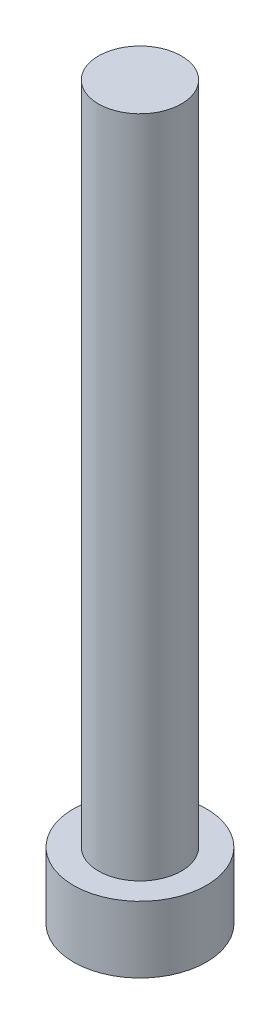
from build123d import *

# Parameters (mm, degrees)
SKETCH1_R           = 1.25
BOSS_EXTRUDE1_DEPTH = 20
SKETCH1_4_R         = 2
BOSS_EXTRUDE2_DEPTH = 2


with BuildPart() as part:
    # Sketch1 → Boss-Extrude1 (new body)
    with BuildSketch(Plane(origin=(0, 0, 0), x_dir=(1, 0, 0), z_dir=(0, 1, 0))):
        Circle(SKETCH1_R)
    extrude(amount=BOSS_EXTRUDE1_DEPTH)

    # Sketch1<4> → Boss-Extrude2 (add)
    with BuildSketch(Plane(origin=(0, 0, 0), x_dir=(1, 0, 0), z_dir=(0, 1, 0))):
        Circle(SKETCH1_4_R)
    extrude(amount=-BOSS_EXTRUDE2_DEPTH)


solid = part.part
